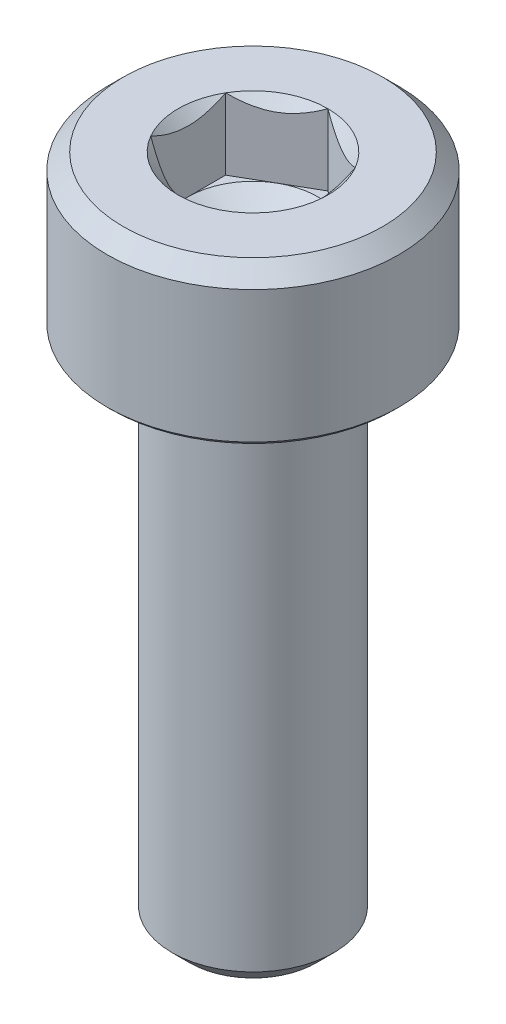
from build123d import *

# Parameters (mm, degrees)
CUT_EXTRUDE1_DEPTH = 1.1


with BuildPart() as part:
    # Sketch1 → Revolve1 (revolve)
    with BuildSketch(Plane.XY):
        Polygon((0, 0.672649731), (1, 1.25), (1, 2.195299462), (1.154700538, 2.35), (2, 2.35), (2.25, 2.1), (2.25, 0.0625), (2.1875, 0), (1.3, 0), (1.25, -0.51), (1.25, -7.724), (0.974, -8), (0, -8), align=None)
    revolve(axis=Axis((0, -8, 0), (0, 1, 0)))

    # Sketch2 → Cut-Extrude1 (cut)
    with BuildSketch(Plane(origin=(0, 2.35, 0), x_dir=(1, 0, 0), z_dir=(0, 1, 0))):
        Polygon((-1, -0.577350269), (0, -1.154700538), (1, -0.577350269), (1, 0.577350269), (0, 1.154700538), (-1, 0.577350269), align=None)
    extrude(amount=-CUT_EXTRUDE1_DEPTH, mode=Mode.SUBTRACT)


solid = part.part
